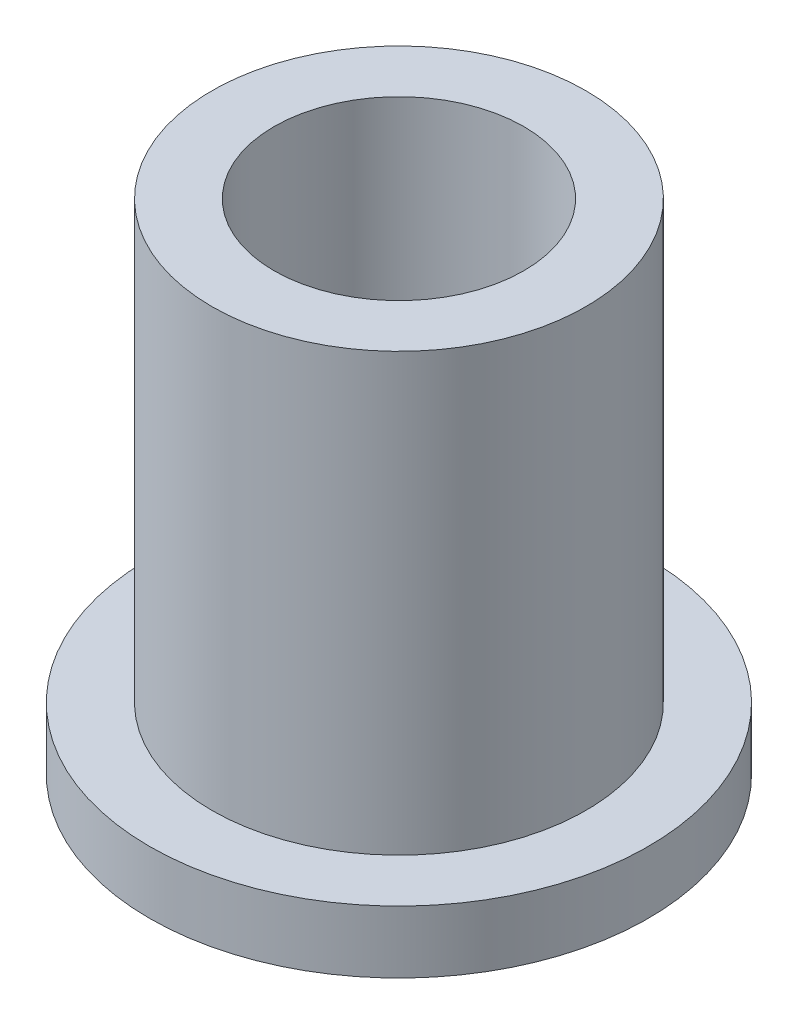
from build123d import *

# Parameters (mm, degrees)
SKETCH2_R           = 9.525
SKETCH2_R_2         = 6.3627
BOSS_EXTRUDE1_DEPTH = 25.4
SKETCH3_R           = 12.7
SKETCH3_R_2         = 9.525
BOSS_EXTRUDE2_DEPTH = 3.175


with BuildPart() as part:
    # Sketch2 → Boss-Extrude1 (new body)
    with BuildSketch(Plane(origin=(0, 0, 0), x_dir=(1, 0, 0), z_dir=(0, 1, 0))):
        with Locations(Location((0, 0, 0), (0, 0, 270))):
            Circle(SKETCH2_R)
        with Locations(Location((0, 0, 0), (0, 0, 270))):
            Circle(SKETCH2_R_2, mode=Mode.SUBTRACT)
    extrude(amount=BOSS_EXTRUDE1_DEPTH)

    # Sketch3 → Boss-Extrude2 (add)
    with BuildSketch(Plane(origin=(0, 0, 0), x_dir=(1, 0, 0), z_dir=(0, 1, 0))):
        with Locations(Location((0, 0, 0), (0, 0, 270))):
            Circle(SKETCH3_R)
        with Locations(Location((0, 0, 0), (0, 0, 270))):
            Circle(SKETCH3_R_2, mode=Mode.SUBTRACT)
    extrude(amount=BOSS_EXTRUDE2_DEPTH)


solid = part.part
